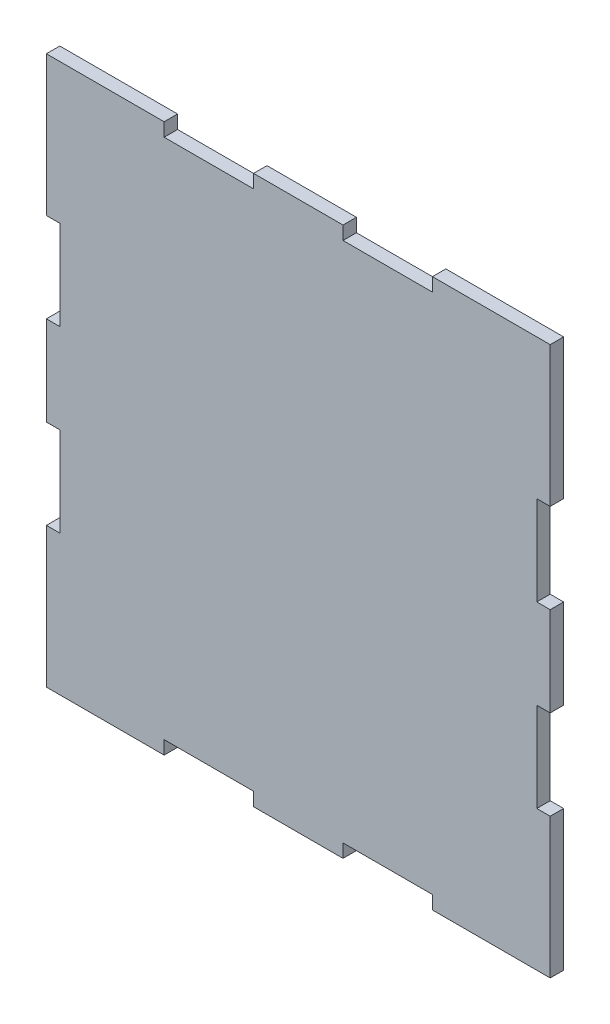
from build123d import *

# Parameters (mm, degrees)
BOSS_EXTRUDE1_DEPTH = 9


with BuildPart() as part:
    # Sketch1 → Boss-Extrude1 (new body)
    with BuildSketch(Plane.XY):
        Polygon((320, 269.84), (311, 269.84), (311, 209.84), (320, 209.84), (320, 149.84), (311, 149.84), (311, 89.84), (320, 89.84), (320, -4.16), (311, -4.16), (241, -4.16), (241, 4.84), (181, 4.84), (181, -4.16), (121, -4.16), (121, 4.84), (61, 4.84), (61, -4.16), (-9, -4.16), (-18, -4.16), (-18, 89.84), (-9, 89.84), (-9, 149.84), (-18, 149.84), (-18, 209.84), (-9, 209.84), (-9, 269.84), (-18, 269.84), (-18, 363.84), (-9, 363.84), (61, 363.84), (61, 354.84), (121, 354.84), (121, 363.84), (181, 363.84), (181, 354.84), (241, 354.84), (241, 363.84), (311, 363.84), (320, 363.84), align=None)
    extrude(amount=BOSS_EXTRUDE1_DEPTH)


solid = part.part
